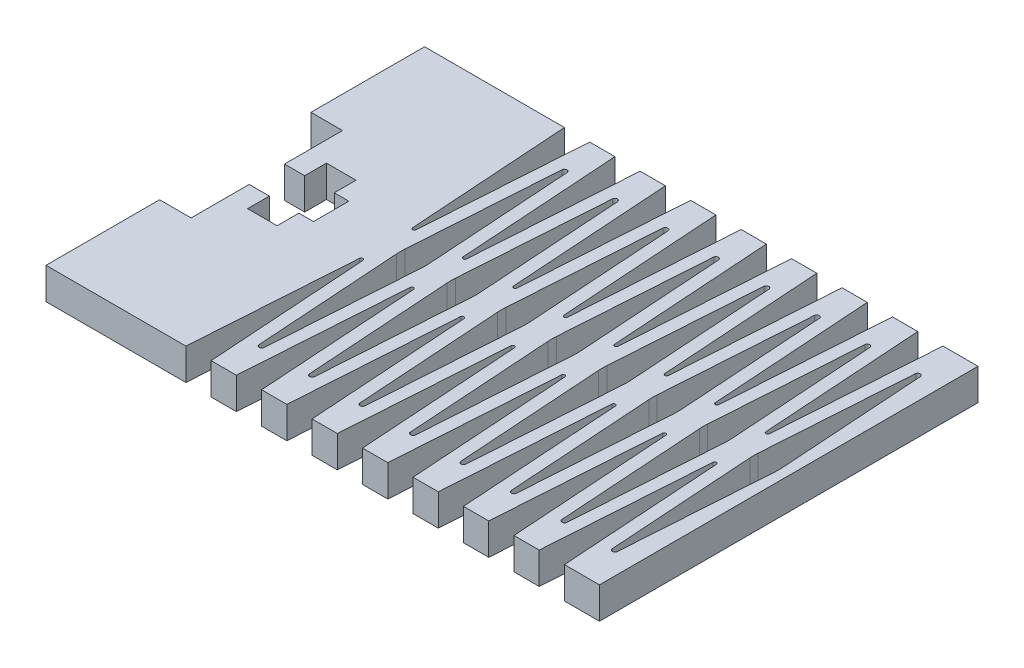
from build123d import *

# Parameters (mm, degrees)
BOSS_EXTRUDE1_DEPTH = 3.175
CUT_EXTRUDE1_DEPTH  = 68.560739298


with BuildPart() as part:
    # Sketch1 → Boss-Extrude1 (new body)
    with BuildSketch(Plane(origin=(0, 0, 0), x_dir=(1, 0, 0), z_dir=(0, 1, 0))):
        with BuildLine():
            Line((0, 11.43), (3.175, 11.43))
            Line((3.175, 11.43), (3.175, 17.272))
            Line((3.175, 17.272), (5.207, 17.272))
            Line((5.207, 17.272), (5.207, 15.08125))
            Line((5.207, 15.08125), (8.1835625, 15.08125))
            Line((8.1835625, 15.08125), (8.1835625, 17.272))
            Line((8.1835625, 17.272), (9.652, 17.272))
            Line((9.652, 17.272), (9.652, 20.828))
            Line((9.652, 20.828), (8.1835625, 20.828))
            Line((8.1835625, 20.828), (8.1835625, 23.01875))
            Line((8.1835625, 23.01875), (5.207, 23.01875))
            Line((5.207, 23.01875), (5.207, 20.828))
            Line((5.207, 20.828), (3.175, 20.828))
            Line((3.175, 20.828), (3.175, 26.67))
            Line((3.175, 26.67), (0, 26.67))
            Line((0, 26.67), (0, 38.1))
            Line((0, 38.1), (14.078915606, 38.1))
            Line((14.078915606, 38.1), (15.171509405, 21.711093016))
            ThreePointArc((15.171509405, 21.711093016), (15.348915606, 21.545120096), (15.526321807, 21.711093016))
            Line((15.526321807, 21.711093016), (16.618915606, 38.1))
            Line((16.618915606, 38.1), (19.158915606, 38.1))
            Line((19.158915606, 38.1), (20.251509405, 21.711093016))
            ThreePointArc((20.251509405, 21.711093016), (20.428915606, 21.545120096), (20.606321807, 21.711093016))
            Line((20.606321807, 21.711093016), (21.698915606, 38.1))
            Line((21.698915606, 38.1), (24.238915606, 38.1))
            Line((24.238915606, 38.1), (25.331509405, 21.711093016))
            ThreePointArc((25.331509405, 21.711093016), (25.508915606, 21.545120096), (25.686321807, 21.711093016))
            Line((25.686321807, 21.711093016), (26.778915606, 38.1))
            Line((26.778915606, 38.1), (29.318915606, 38.1))
            Line((29.318915606, 38.1), (30.411509405, 21.711093016))
            ThreePointArc((30.411509405, 21.711093016), (30.588915606, 21.545120096), (30.766321807, 21.711093016))
            Line((30.766321807, 21.711093016), (31.858915606, 38.1))
            Line((31.858915606, 38.1), (34.398915606, 38.1))
            Line((34.398915606, 38.1), (35.491509405, 21.711093016))
            ThreePointArc((35.491509405, 21.711093016), (35.668915606, 21.545120096), (35.846321807, 21.711093016))
            Line((35.846321807, 21.711093016), (36.938915606, 38.1))
            Line((36.938915606, 38.1), (39.478915606, 38.1))
            Line((39.478915606, 38.1), (40.571509405, 21.711093016))
            ThreePointArc((40.571509405, 21.711093016), (40.748915606, 21.545120096), (40.926321807, 21.711093016))
            Line((40.926321807, 21.711093016), (42.018915606, 38.1))
            Line((42.018915606, 38.1), (44.558915606, 38.1))
            Line((44.558915606, 38.1), (45.651509405, 21.711093016))
            ThreePointArc((45.651509405, 21.711093016), (45.828915606, 21.545120096), (46.006321807, 21.711093016))
            Line((46.006321807, 21.711093016), (47.098915606, 38.1))
            Line((47.098915606, 38.1), (49.638915606, 38.1))
            Line((49.638915606, 38.1), (50.731509405, 21.711093016))
            ThreePointArc((50.731509405, 21.711093016), (50.908915606, 21.545120096), (51.086321807, 21.711093016))
            Line((51.086321807, 21.711093016), (52.178915606, 38.1))
            Line((52.178915606, 38.1), (55.702449403, 38.1))
            Line((55.702449403, 38.1), (55.702449403, 0))
            Line((55.702449403, 0), (52.178915606, 0))
            Line((52.178915606, 0), (51.086321807, 16.388906984))
            ThreePointArc((51.086321807, 16.388906984), (50.908915606, 16.554879904), (50.731509405, 16.388906984))
            Line((50.731509405, 16.388906984), (49.638915606, 0))
            Line((49.638915606, 0), (47.098915606, 0))
            Line((47.098915606, 0), (46.006321807, 16.388906984))
            ThreePointArc((46.006321807, 16.388906984), (45.828915606, 16.554879904), (45.651509405, 16.388906984))
            Line((45.651509405, 16.388906984), (44.558915606, 0))
            Line((44.558915606, 0), (42.018915606, 0))
            Line((42.018915606, 0), (40.926321807, 16.388906984))
            ThreePointArc((40.926321807, 16.388906984), (40.748915606, 16.554879904), (40.571509405, 16.388906984))
            Line((40.571509405, 16.388906984), (39.478915606, 0))
            Line((39.478915606, 0), (36.938915606, 0))
            Line((36.938915606, 0), (35.846321807, 16.388906984))
            ThreePointArc((35.846321807, 16.388906984), (35.668915606, 16.554879904), (35.491509405, 16.388906984))
            Line((35.491509405, 16.388906984), (34.398915606, 0))
            Line((34.398915606, 0), (31.858915606, 0))
            Line((31.858915606, 0), (30.766321807, 16.388906984))
            ThreePointArc((30.766321807, 16.388906984), (30.588915606, 16.554879904), (30.411509405, 16.388906984))
            Line((30.411509405, 16.388906984), (29.318915606, 0))
            Line((29.318915606, 0), (26.778915606, 0))
            Line((26.778915606, 0), (25.686321807, 16.388906984))
            ThreePointArc((25.686321807, 16.388906984), (25.508915606, 16.554879904), (25.331509405, 16.388906984))
            Line((25.331509405, 16.388906984), (24.238915606, 0))
            Line((24.238915606, 0), (21.698915606, 0))
            Line((21.698915606, 0), (20.606321807, 16.388906984))
            ThreePointArc((20.606321807, 16.388906984), (20.428915606, 16.554879904), (20.251509405, 16.388906984))
            Line((20.251509405, 16.388906984), (19.158915606, 0))
            Line((19.158915606, 0), (16.618915606, 0))
            Line((16.618915606, 0), (15.526321807, 16.388906984))
            ThreePointArc((15.526321807, 16.388906984), (15.348915606, 16.554879904), (15.171509405, 16.388906984))
            Line((15.171509405, 16.388906984), (14.078915606, 0))
            Line((14.078915606, 0), (0, 0))
            Line((0, 0), (0, 11.43))
        make_face()
    extrude(amount=BOSS_EXTRUDE1_DEPTH)

    # Sketch3 → Cut-Extrude1 (cut, through all)
    with BuildSketch(Plane(origin=(0, 3.175, 0), x_dir=(1, 0, 0), z_dir=(0, 1, 0))):
        with BuildLine():
            Line((17.635478176, 34.298438549), (16.647075321, 19.472395717))
            ThreePointArc((16.647075321, 19.472395717), (16.633011073, 19.05), (16.647075321, 18.627604283))
            Line((16.647075321, 18.627604283), (17.635478176, 3.801561451))
            ThreePointArc((17.635478176, 3.801561451), (17.888915606, 3.56445728), (18.142353036, 3.801561451))
            Line((18.142353036, 3.801561451), (19.130755892, 18.627604283))
            ThreePointArc((19.130755892, 18.627604283), (19.144820139, 19.05), (19.130755892, 19.472395717))
            Line((19.130755892, 19.472395717), (18.142353036, 34.298438549))
            ThreePointArc((18.142353036, 34.298438549), (17.888915606, 34.53554272), (17.635478176, 34.298438549))
        make_face()
        with BuildLine():
            Line((21.727075321, 18.627604283), (22.715478176, 3.801561451))
            ThreePointArc((22.715478176, 3.801561451), (22.968915606, 3.56445728), (23.222353036, 3.801561451))
            Line((23.222353036, 3.801561451), (24.210755892, 18.627604283))
            ThreePointArc((24.210755892, 18.627604283), (24.224820139, 19.05), (24.210755892, 19.472395717))
            Line((24.210755892, 19.472395717), (23.222353036, 34.298438549))
            ThreePointArc((23.222353036, 34.298438549), (22.968915606, 34.53554272), (22.715478176, 34.298438549))
            Line((22.715478176, 34.298438549), (21.727075321, 19.472395717))
            ThreePointArc((21.727075321, 19.472395717), (21.713011073, 19.05), (21.727075321, 18.627604283))
        make_face()
        with BuildLine():
            Line((26.807075321, 18.627604283), (27.795478176, 3.801561451))
            ThreePointArc((27.795478176, 3.801561451), (28.048915606, 3.56445728), (28.302353036, 3.801561451))
            Line((28.302353036, 3.801561451), (29.290755892, 18.627604283))
            ThreePointArc((29.290755892, 18.627604283), (29.304820139, 19.05), (29.290755892, 19.472395717))
            Line((29.290755892, 19.472395717), (28.302353036, 34.298438549))
            ThreePointArc((28.302353036, 34.298438549), (28.048915606, 34.53554272), (27.795478176, 34.298438549))
            Line((27.795478176, 34.298438549), (26.807075321, 19.472395717))
            ThreePointArc((26.807075321, 19.472395717), (26.793011073, 19.05), (26.807075321, 18.627604283))
        make_face()
        with BuildLine():
            Line((31.887075321, 18.627604283), (32.875478176, 3.801561451))
            ThreePointArc((32.875478176, 3.801561451), (33.128915606, 3.56445728), (33.382353036, 3.801561451))
            Line((33.382353036, 3.801561451), (34.370755892, 18.627604283))
            ThreePointArc((34.370755892, 18.627604283), (34.384820139, 19.05), (34.370755892, 19.472395717))
            Line((34.370755892, 19.472395717), (33.382353036, 34.298438549))
            ThreePointArc((33.382353036, 34.298438549), (33.128915606, 34.53554272), (32.875478176, 34.298438549))
            Line((32.875478176, 34.298438549), (31.887075321, 19.472395717))
            ThreePointArc((31.887075321, 19.472395717), (31.873011073, 19.05), (31.887075321, 18.627604283))
        make_face()
        with BuildLine():
            Line((36.967075321, 18.627604283), (37.955478176, 3.801561451))
            ThreePointArc((37.955478176, 3.801561451), (38.208915606, 3.56445728), (38.462353036, 3.801561451))
            Line((38.462353036, 3.801561451), (39.450755892, 18.627604283))
            ThreePointArc((39.450755892, 18.627604283), (39.464820139, 19.05), (39.450755892, 19.472395717))
            Line((39.450755892, 19.472395717), (38.462353036, 34.298438549))
            ThreePointArc((38.462353036, 34.298438549), (38.208915606, 34.53554272), (37.955478176, 34.298438549))
            Line((37.955478176, 34.298438549), (36.967075321, 19.472395717))
            ThreePointArc((36.967075321, 19.472395717), (36.953011073, 19.05), (36.967075321, 18.627604283))
        make_face()
        with BuildLine():
            Line((42.047075321, 18.627604283), (43.035478176, 3.801561451))
            ThreePointArc((43.035478176, 3.801561451), (43.288915606, 3.56445728), (43.542353036, 3.801561451))
            Line((43.542353036, 3.801561451), (44.530755892, 18.627604283))
            ThreePointArc((44.530755892, 18.627604283), (44.544820139, 19.05), (44.530755892, 19.472395717))
            Line((44.530755892, 19.472395717), (43.542353036, 34.298438549))
            ThreePointArc((43.542353036, 34.298438549), (43.288915606, 34.53554272), (43.035478176, 34.298438549))
            Line((43.035478176, 34.298438549), (42.047075321, 19.472395717))
            ThreePointArc((42.047075321, 19.472395717), (42.033011073, 19.05), (42.047075321, 18.627604283))
        make_face()
        with BuildLine():
            Line((47.127075321, 18.627604283), (48.115478176, 3.801561451))
            ThreePointArc((48.115478176, 3.801561451), (48.368915606, 3.56445728), (48.622353036, 3.801561451))
            Line((48.622353036, 3.801561451), (49.610755892, 18.627604283))
            ThreePointArc((49.610755892, 18.627604283), (49.624820139, 19.05), (49.610755892, 19.472395717))
            Line((49.610755892, 19.472395717), (48.622353036, 34.298438549))
            ThreePointArc((48.622353036, 34.298438549), (48.368915606, 34.53554272), (48.115478176, 34.298438549))
            Line((48.115478176, 34.298438549), (47.127075321, 19.472395717))
            ThreePointArc((47.127075321, 19.472395717), (47.113011073, 19.05), (47.127075321, 18.627604283))
        make_face()
        with BuildLine():
            Line((52.207075321, 18.627604283), (53.195478176, 3.801561451))
            ThreePointArc((53.195478176, 3.801561451), (53.448915606, 3.56445728), (53.702353036, 3.801561451))
            Line((53.702353036, 3.801561451), (54.690755892, 18.627604283))
            ThreePointArc((54.690755892, 18.627604283), (54.704820139, 19.05), (54.690755892, 19.472395717))
            Line((54.690755892, 19.472395717), (53.702353036, 34.298438549))
            ThreePointArc((53.702353036, 34.298438549), (53.448915606, 34.53554272), (53.195478176, 34.298438549))
            Line((53.195478176, 34.298438549), (52.207075321, 19.472395717))
            ThreePointArc((52.207075321, 19.472395717), (52.193011073, 19.05), (52.207075321, 18.627604283))
        make_face()
    extrude(amount=-CUT_EXTRUDE1_DEPTH, mode=Mode.SUBTRACT)


solid = part.part
